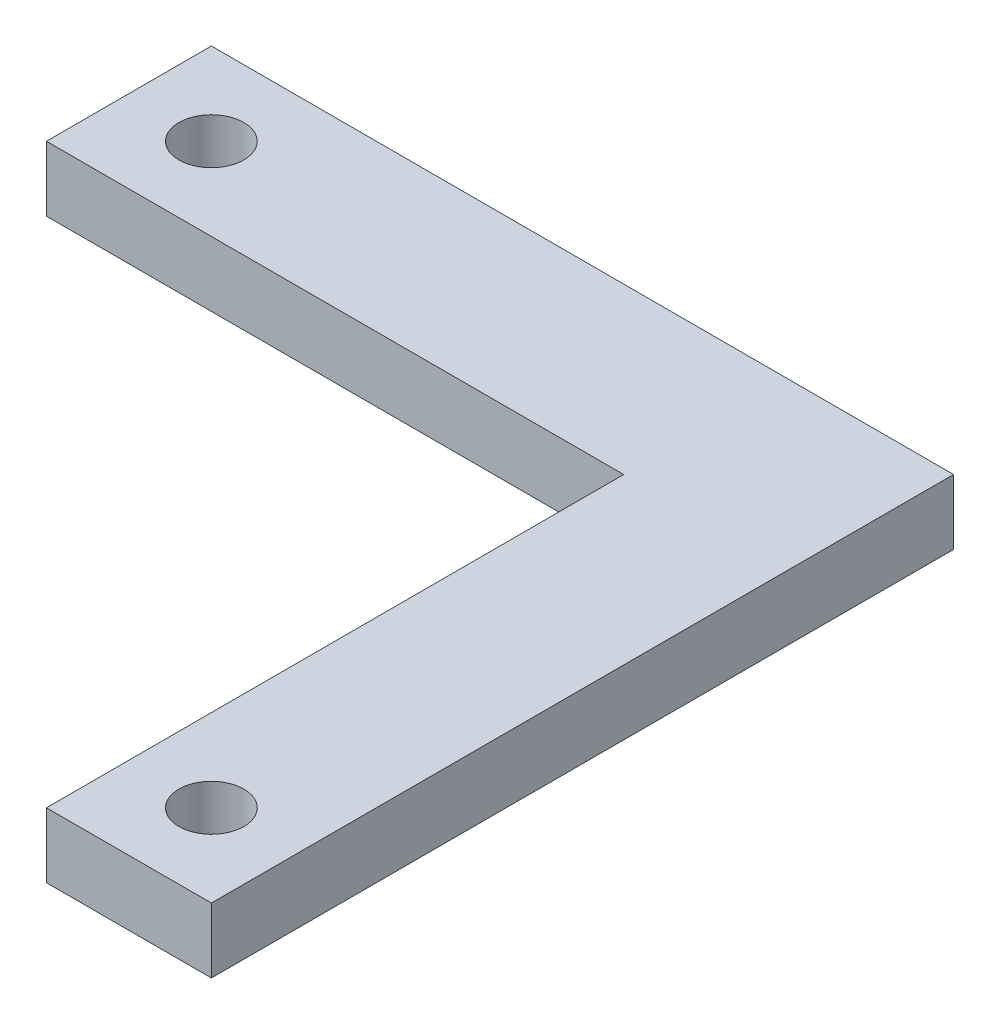
from build123d import *

# Parameters (mm, degrees)
SKETCH1_R           = 2.5
BOSS_EXTRUDE1_DEPTH = 5


with BuildPart() as part:
    # Sketch1 → Boss-Extrude1 (new body)
    with BuildSketch(Plane(origin=(0, 0, 0), x_dir=(1, 0, 0), z_dir=(0, 1, 0))):
        Polygon((0, 0), (0, 12.7), (57.15, 12.7), (57.15, 0), (57.15, -44.45), (44.45, -44.45), (44.45, 0), align=None)
        with Locations(Location((6.35, 6.35, 0), (0, 0, 270))):
            Circle(SKETCH1_R, mode=Mode.SUBTRACT)
        with Locations(Location((50.8, -38.1, 0), (0, 0, 270))):
            Circle(SKETCH1_R, mode=Mode.SUBTRACT)
    extrude(amount=BOSS_EXTRUDE1_DEPTH)


solid = part.part
